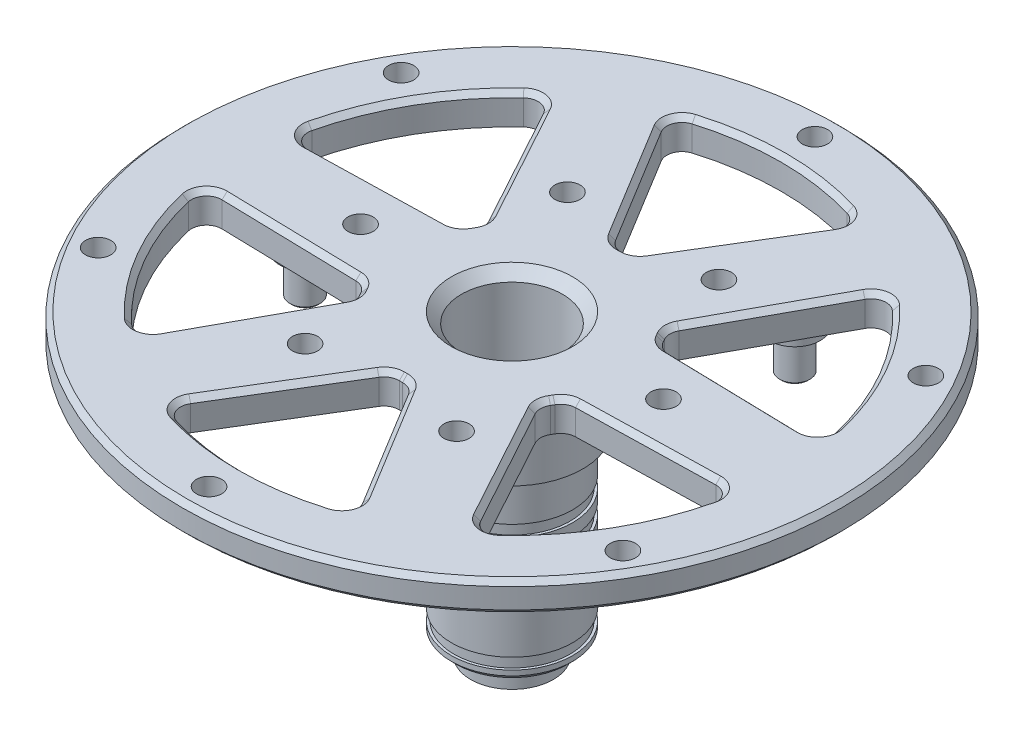
from build123d import *

# Parameters (mm, degrees)
CIRPATTERN1_COUNT        = 3
CHAMFER1_SIZE            = 0.5
CHAMFER2_SIZE            = 1
CUT_EXTRUDE1_DEPTH       = 51.319429647
FILLET1_R                = 1.5
M3X0_5_TAPPED_HOLE1_D    = 2.5
CIRPATTERN2_COUNT        = 6
FILLET1_OF_CIRPATTERN2_R = 1.5
SKETCH10_W               = 1.207732619
SKETCH10_H               = 1.1
SKETCH11_W               = 3.151954219
SKETCH11_H               = 1.1
M3X0_5_TAPPED_HOLE2_D    = 2.5
CIRPATTERN3_COUNT        = 6
CHAMFER3_SIZE            = 0.5
CHAMFER4_SIZE            = 0.2


with BuildPart() as part:
    # Sketch2 → Revolve1 (revolve)
    with BuildSketch(Plane.XY):
        Polygon((-4, 10), (-4, -6.5), (-3.1, -6.5), (-3.1, -9.5), (-4.1, -9.5), (-4.1, -7.5), (-6, -7.5), (-6, 10), (-7, 10), (-7, 17), (-32.65, 17), (-32.65, 20), (-5, 20), (-5, 11), align=None)
    revolve(axis=Axis((0, 0, 0), (0, -1, 0)))

    # Sketch3 → Revolve2 (revolve)
    with BuildSketch(Plane.XY):
        Polygon((-22, 15), (-23, 15), (-23, 17), (-20.5, 17), (-20.5, 11), (-22, 11), align=None)
    revolve2 = revolve(axis=Axis((-20.5, 18.273035546, 0), (0, -1, 0)))

    # CirPattern1: Revolve2 ×3 about axis
    cirpattern1_axis = Axis((0, 0, 0), (0, 1, 0))
    for i in range(1, CIRPATTERN1_COUNT):
        add(revolve2.rotate(cirpattern1_axis, i * 360 / CIRPATTERN1_COUNT))

    # Chamfer1
    chamfer1_edges = [part.edges().sort_by_distance(p)[0] for p in [
        (32.65, 20, 0),
        (32.65, 17, 0),
    ]]
    chamfer(chamfer1_edges, length=CHAMFER1_SIZE)

    # Chamfer2
    chamfer2_edges = [part.edges().sort_by_distance(p)[0] for p in [
        (5, 20, 0),
    ]]
    chamfer(chamfer2_edges, length=CHAMFER2_SIZE)

    # Sketch6 → Cut-Extrude1 (cut, through all)
    with BuildSketch(Plane(origin=(0, 0, 0), x_dir=(1, 0, 0), z_dir=(0, 1, 0))):
        with BuildLine():
            Line((26.313380417, 4.222382152), (9.986832981, 4.611200171))
            ThreePointArc((9.986832981, 4.611200171), (9.526279442, 5.5), (8.986832981, 6.343250979))
            Line((8.986832981, 6.343250979), (16.813380417, 20.676864824))
            ThreePointArc((16.813380417, 20.676864824), (23.079577011, 13.325), (26.313380417, 4.222382152))
        make_face()
    cut_extrude1 = extrude(amount=CUT_EXTRUDE1_DEPTH, mode=Mode.SUBTRACT)

    # Fillet1
    fillet1_edges = [part.edges().sort_by_distance(p)[0] for p in [
        (26.313380417, 18.5, -4.222382152),
        (9.986832981, 18.5, -4.611200171),
        (8.986832981, 18.5, -6.343250979),
        (16.813380417, 18.5, -20.676864824),
    ]]
    fillet(fillet1_edges, radius=FILLET1_R)

    # M3x0.5 Tapped Hole1 (through all)
    with Locations(Plane(origin=(0, 20, 0), x_dir=(1, 0, 0), z_dir=(0, 1, 0))):
        with Locations((15, 0)):
            m3x0_5_tapped_hole1 = Hole(M3X0_5_TAPPED_HOLE1_D / 2)

    # CirPattern2: Cut-Extrude1, M3x0.5 Tapped Hole1 ×6 about axis
    cirpattern2_axis = Axis((0, 0, 0), (0, 1, 0))
    add([cut_extrude1.rotate(cirpattern2_axis, i * 360 / CIRPATTERN2_COUNT) for i in range(1, CIRPATTERN2_COUNT)], mode=Mode.SUBTRACT)
    add([m3x0_5_tapped_hole1.rotate(cirpattern2_axis, i * 360 / CIRPATTERN2_COUNT) for i in range(1, CIRPATTERN2_COUNT)], mode=Mode.SUBTRACT)

    # Fillet1 of CirPattern2
    fillet1_of_cirpattern2_edges = [part.edges().sort_by_distance(p)[0] for p in [
        (9.5, 18.5, -24.899246977),
        (1, 18.5, -10.95445115),
        (-1, 18.5, -10.95445115),
        (-9.5, 18.5, -24.899246977),
        (-16.813380417, 18.5, -20.676864824),
        (-8.986832981, 18.5, -6.343250979),
        (-9.986832981, 18.5, -4.611200171),
        (-26.313380417, 18.5, -4.222382152),
        (-26.313380417, 18.5, 4.222382152),
        (-9.986832981, 18.5, 4.611200171),
        (-8.986832981, 18.5, 6.343250979),
        (-16.813380417, 18.5, 20.676864824),
        (-9.5, 18.5, 24.899246977),
        (-1, 18.5, 10.95445115),
        (1, 18.5, 10.95445115),
        (9.5, 18.5, 24.899246977),
        (16.813380417, 18.5, 20.676864824),
        (8.986832981, 18.5, 6.343250979),
        (9.986832981, 18.5, 4.611200171),
        (26.313380417, 18.5, 4.222382152),
    ]]
    fillet(fillet1_of_cirpattern2_edges, radius=FILLET1_OF_CIRPATTERN2_R)

    # Sketch9 → Cut-Revolve1 (revolve, cut)
    with BuildSketch(Plane.XY):
        Polygon((-8.538708616, -5.4), (-5.75, -5.4), (-5.75, -6.5), (-6.5, -6.5), (-5.5, -7.5), (-8.538708616, -7.5), align=None)
    revolve(axis=Axis((0, 0, 0), (0, -1, 0)), mode=Mode.SUBTRACT)

    # Sketch10 → Cut-Revolve2 (revolve, cut)
    with BuildSketch(Plane.XY):
        with Locations((-6.35386631, 5.45)):
            Rectangle(SKETCH10_W, SKETCH10_H)
    revolve(axis=Axis((0, 0, 0), (0, 1, 0)), mode=Mode.SUBTRACT)

    # Sketch11 → Cut-Revolve3 (revolve, cut)
    with BuildSketch(Plane.XY):
        with Locations((-7.32597711, 3.15)):
            Rectangle(SKETCH11_W, SKETCH11_H)
    revolve(axis=Axis((0, 0, 0), (0, -1, 0)), mode=Mode.SUBTRACT)

    # M3x0.5 Tapped Hole2 (through all)
    with Locations(Plane(origin=(0, 20, 0), x_dir=(1, 0, 0), z_dir=(0, 1, 0))):
        with Locations((0, 30)):
            m3x0_5_tapped_hole2 = Hole(M3X0_5_TAPPED_HOLE2_D / 2)

    # CirPattern3: M3x0.5 Tapped Hole2 ×6 about axis
    cirpattern3_axis = Axis((0, 0, 0), (0, 1, 0))
    for i in range(1, CIRPATTERN3_COUNT):
        add(m3x0_5_tapped_hole2.rotate(cirpattern3_axis, i * 360 / CIRPATTERN3_COUNT), mode=Mode.SUBTRACT)

    # Chamfer3
    chamfer3_edges = [part.edges().sort_by_distance(p)[0] for p in [
        (-9.526279442, 20, -5.5),
        (-9.232137893, 20, -6.380220105),
        (-10.141501639, 20, -4.805155894),
        (-12.666357528, 20, -13.081967435),
        (-17.662494894, 20, -4.428403676),
        (-16.997842711, 20, -19.798373681),
        (-25.644815917, 20, -4.821376756),
        (-23.079577011, 20, -13.325),
        (9.526279442, 20, -5.5),
        (10.141501639, 20, -4.805155894),
        (9.232137893, 20, -6.380220105),
        (17.662494894, 20, -4.428403676),
        (12.666357528, 20, -13.081967435),
        (25.644815917, 20, -4.821376756),
        (16.997842711, 20, -19.798373681),
        (23.079577011, 20, -13.325),
        (0, 20, -11),
        (0.909363746, 20, -11.185375999),
        (-0.909363746, 20, -11.185375999),
        (4.996137366, 20, -17.51037111),
        (-4.996137366, 20, -17.51037111),
        (8.646973206, 20, -24.619750438),
        (-8.646973206, 20, -24.619750438),
        (0, 20, -26.65),
        (-17.662494894, 20, 4.428403676),
        (-25.644815917, 20, 4.821376756),
        (-10.141501639, 20, 4.805155894),
        (-23.079577011, 20, 13.325),
        (-9.526279442, 20, 5.5),
        (-16.997842711, 20, 19.798373681),
        (-9.232137893, 20, 6.380220105),
        (-12.666357528, 20, 13.081967435),
        (-4.996137366, 20, 17.51037111),
        (-8.646973206, 20, 24.619750438),
        (-0.909363746, 20, 11.185375999),
        (0, 20, 26.65),
        (0, 20, 11),
        (8.646973206, 20, 24.619750438),
        (0.909363746, 20, 11.185375999),
        (4.996137366, 20, 17.51037111),
        (17.662494894, 20, 4.428403676),
        (10.141501639, 20, 4.805155894),
        (25.644815917, 20, 4.821376756),
        (9.526279442, 20, 5.5),
        (23.079577011, 20, 13.325),
        (9.232137893, 20, 6.380220105),
        (16.997842711, 20, 19.798373681),
        (12.666357528, 20, 13.081967435),
    ]]
    chamfer(chamfer3_edges, length=CHAMFER3_SIZE)

    # Chamfer4
    chamfer4_edges = [part.edges().sort_by_distance(p)[0] for p in [
        (9.5, 11, -16.454482672),
        (9.5, 11, 16.454482672),
        (-19, 11, 0),
    ]]
    chamfer(chamfer4_edges, length=CHAMFER4_SIZE)


solid = part.part
